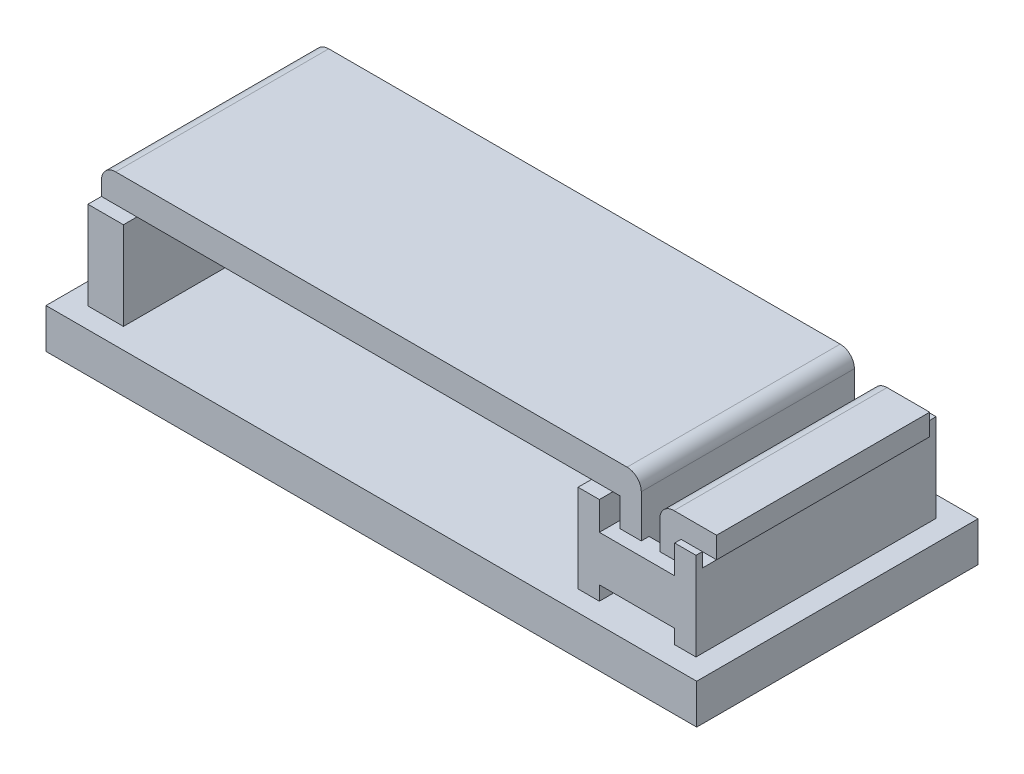
from build123d import *

# Parameters (mm, degrees)
BASE_OUTLINE_W              = 45.8
BASE_OUTLINE_H              = 19.8
CLAMP_BASE_DEPTH            = 2.8
HINGE_AND_LATCH_OUTLINE_W   = 2.5
HINGE_AND_LATCH_OUTLINE_H   = 6.2
HINGE_AND_LATCH_OUTLINE_W_2 = 8.3
CLIP_HINGE_AND_LATCH_DEPTH  = 8.45
LATCH_SIDES_CUT_REACH       = 32.694
SIDE_CUTS_OUTLINE_W         = 5.3
SIDE_CUTS_OUTLINE_H         = 2
SIDE_CUTS_OUTLINE_H_2       = 1
LATCH_THROUGH_CUT_REACH     = 27.912
THROUGH_CUT_OUTLINE_W       = 5.3
THROUGH_CUT_OUTLINE_H       = 13.9
LATCH_FRONT_CUT_REACH       = 48.276
FRONT_CUT_OUTLINE_W         = 16
FRONT_CUT_OUTLINE_H         = 1
CLAMP_DEPTH                 = 7.5
CLAMP_FILLETS_R             = 1


with BuildPart() as part:
    # Base Outline → Clamp Base (new body)
    with BuildSketch(Plane(origin=(0, 0, 0), x_dir=(1, 0, 0), z_dir=(0, 1, 0))):
        Rectangle(BASE_OUTLINE_W, BASE_OUTLINE_H)
    extrude(amount=CLAMP_BASE_DEPTH)

    # Hinge and Latch Outline → Clip Hinge and Latch (add, symmetric)
    with BuildSketch(Plane.XY):
        with Locations((-20.15, 5.9)):
            Rectangle(HINGE_AND_LATCH_OUTLINE_W, HINGE_AND_LATCH_OUTLINE_H)
        with Locations((17.25, 5.9)):
            Rectangle(HINGE_AND_LATCH_OUTLINE_W_2, HINGE_AND_LATCH_OUTLINE_H)
    extrude(amount=CLIP_HINGE_AND_LATCH_DEPTH, both=True)

    # Side Cuts Outline → Latch Sides Cut (cut, up to next)
    with BuildSketch(Plane.XY.offset(8.45), mode=Mode.PRIVATE) as latch_sides_cut_sk1:
        with Locations((17.25, 8)):
            Rectangle(SIDE_CUTS_OUTLINE_W, SIDE_CUTS_OUTLINE_H)
    latch_sides_cut_tool1 = extrude(latch_sides_cut_sk1.sketch, amount=-LATCH_SIDES_CUT_REACH, mode=Mode.PRIVATE) & part.part
    # Side Cuts Outline → Latch Sides Cut (cut, up to next)
    with BuildSketch(Plane.XY.offset(8.45), mode=Mode.PRIVATE) as latch_sides_cut_sk2:
        with Locations((17.25, 3.3)):
            Rectangle(SIDE_CUTS_OUTLINE_W, SIDE_CUTS_OUTLINE_H_2)
    latch_sides_cut_tool2 = extrude(latch_sides_cut_sk2.sketch, amount=-LATCH_SIDES_CUT_REACH, mode=Mode.PRIVATE) & part.part
    add(latch_sides_cut_tool1.solids().sort_by_distance((17.25, 8, 8.45))[0], mode=Mode.SUBTRACT)
    add(latch_sides_cut_tool2.solids().sort_by_distance((17.25, 3.3, 8.45))[0], mode=Mode.SUBTRACT)

    # Through Cut Outline → Latch Through Cut (cut, up to next)
    with BuildSketch(Plane(origin=(0, 7, 0), x_dir=(1, 0, 0), z_dir=(0, 1, 0)), mode=Mode.PRIVATE) as latch_through_cut_sk1:
        with Locations((17.25, 0)):
            Rectangle(THROUGH_CUT_OUTLINE_W, THROUGH_CUT_OUTLINE_H)
    latch_through_cut_tool1 = extrude(latch_through_cut_sk1.sketch, amount=-LATCH_THROUGH_CUT_REACH, mode=Mode.PRIVATE) & part.part
    add(latch_through_cut_tool1.solids().sort_by_distance((17.25, 7, 0))[0], mode=Mode.SUBTRACT)

    # Front Cut Outline → Latch Front Cut (cut, up to next)
    with BuildSketch(Plane(origin=(21.4, 0, 0), x_dir=(0, 0, -1), z_dir=(1, 0, 0)), mode=Mode.PRIVATE) as latch_front_cut_sk1:
        with Locations((0, 8.5)):
            Rectangle(FRONT_CUT_OUTLINE_W, FRONT_CUT_OUTLINE_H)
    latch_front_cut_tool1 = extrude(latch_front_cut_sk1.sketch, amount=-LATCH_FRONT_CUT_REACH, mode=Mode.PRIVATE) & part.part
    add(latch_front_cut_tool1.solids().sort_by_distance((21.4, 8.5, 0))[0], mode=Mode.SUBTRACT)

    # Clamp Outline → Clamp (add, symmetric)
    with BuildSketch(Plane.XY):
        Polygon((-21.4, 9), (15.1, 9), (15.1, 3.3), (19.4, 3.3), (19.4, 8.5), (21.9, 8.5), (21.9, 10), (17.9, 10), (17.9, 4.8), (16.6, 4.8), (16.6, 11), (-21.4, 11), align=None)
    extrude(amount=CLAMP_DEPTH, both=True)

    # Clamp Fillets
    clamp_fillets_edges = [part.edges().sort_by_distance(p)[0] for p in [
        (19.4, 8.5, 0),
        (17.9, 10, 0),
        (16.6, 11, 0),
        (-21.4, 11, 0),
        (19.4, 3.3, 0),
        (15.1, 3.3, 0),
    ]]
    fillet(clamp_fillets_edges, radius=CLAMP_FILLETS_R)


solid = part.part
